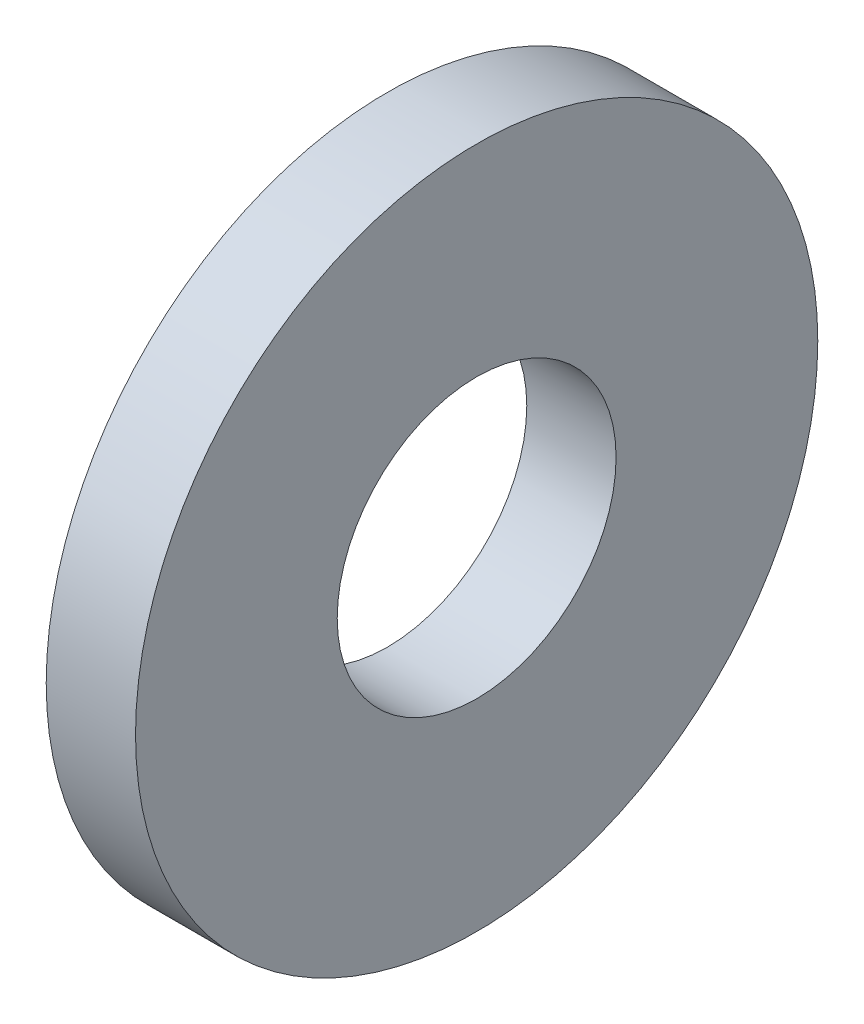
from build123d import *

# Parameters (mm, degrees)
SKETCH1_R           = 8.73125
SKETCH1_R_2         = 3.5687
BOSS_EXTRUDE1_DEPTH = 2.286


with BuildPart() as part:
    # Sketch1 → Boss-Extrude1 (new body)
    with BuildSketch(Plane(origin=(0, 0, 0), x_dir=(0, 0, -1), z_dir=(1, 0, 0))):
        Circle(SKETCH1_R)
        Circle(SKETCH1_R_2, mode=Mode.SUBTRACT)
    extrude(amount=BOSS_EXTRUDE1_DEPTH)


solid = part.part
